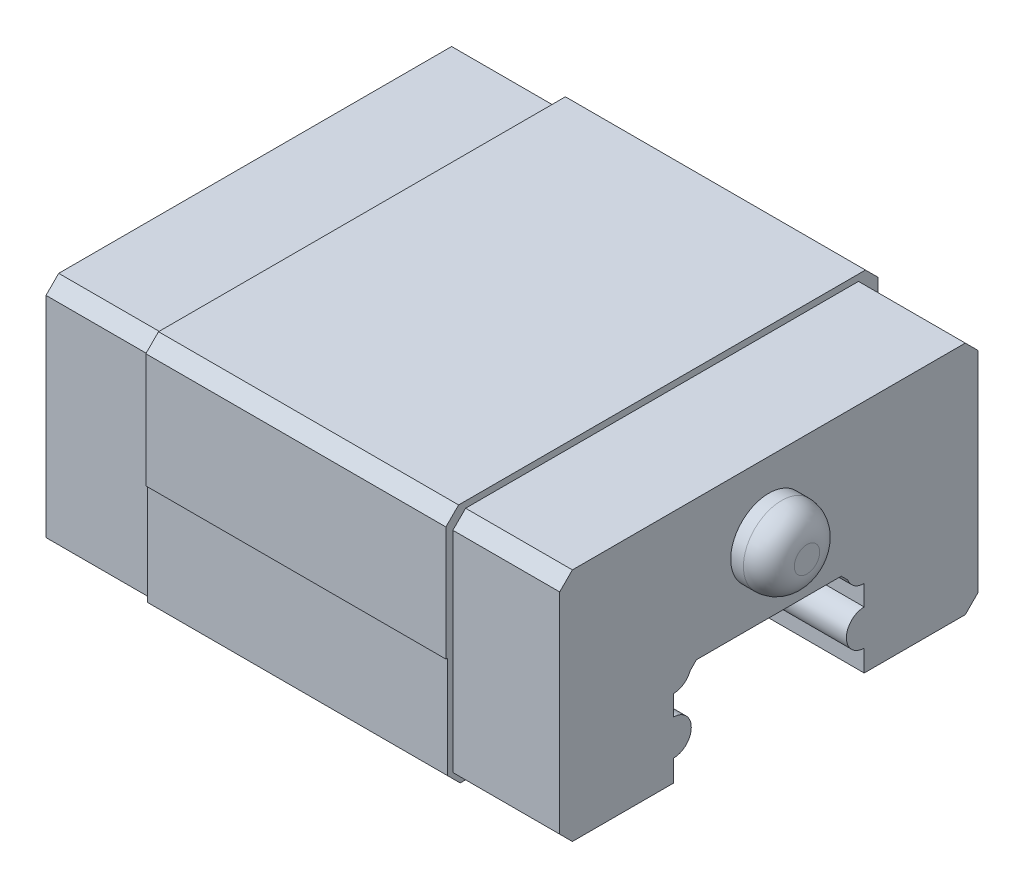
from build123d import *

# Parameters (mm, degrees)
SKETCH1_W               = 34
SKETCH1_H               = 19
BOSS_EXTRUDE1_DEPTH     = 20.2
SKETCH2_OUTSIDE_W       = 47.224
SKETCH2_OUTSIDE_H       = 32.224
SKETCH2_OUTSIDE_W_2     = 32.9
SKETCH2_OUTSIDE_H_2     = 18.5
CUT_EXTRUDE2_DEPTH      = 44.462627624
CUT_EXTRUDE8_DEPTH      = 36.679686097
CUT_EXTRUDE8_DEPTH_BACK = 36.679686097
SKETCH3_W               = 0.125
SKETCH3_H               = 9
CUT_EXTRUDE3_DEPTH      = 23.6
CHAMFER1_SIZE           = 1
CHAMFER2_SIZE           = 1
CHAMFER3_SIZE           = 1
CHAMFER4_SIZE           = 1
SKETCH10_R              = 3
BOSS_EXTRUDE3_DEPTH     = 3
FILLET1_R               = 2
SCALE_1_SCALE           = 1.7


with BuildPart() as part:
    # Sketch1 → Boss-Extrude1 (new, symmetric)
    with BuildSketch(Plane(origin=(0, 0, 0), x_dir=(0, 0, -1), z_dir=(1, 0, 0))):
        with Locations((0, 14.5)):
            Rectangle(SKETCH1_W, SKETCH1_H)
    extrude(amount=BOSS_EXTRUDE1_DEPTH, both=True)

    # Sketch2 outside → Cut-Extrude2 (cut, through all)
    with BuildSketch(Plane(origin=(11.8, 0, 0), x_dir=(0, 0, -1), z_dir=(1, 0, 0))):
        with Locations((0, 14.5)):
            Rectangle(SKETCH2_OUTSIDE_W, SKETCH2_OUTSIDE_H)
        with Locations((0, 14.25)):
            Rectangle(SKETCH2_OUTSIDE_W_2, SKETCH2_OUTSIDE_H_2, mode=Mode.SUBTRACT)
    cut_extrude2 = extrude(amount=CUT_EXTRUDE2_DEPTH, mode=Mode.SUBTRACT)

    # Mirror1: Cut-Extrude2 across plane
    add(cut_extrude2.mirror(Plane(origin=(0, 0, 0), x_dir=(0, 0, 1), z_dir=(1, 0, 0))), mode=Mode.SUBTRACT)

    # Sketch5 → Cut-Extrude8 (cut, two sides: drawn at the far end of the back side and taken through both)
    with BuildSketch(Plane(origin=(0, 0, 0), x_dir=(0, 0, -1), z_dir=(1, 0, 0)).offset(-CUT_EXTRUDE8_DEPTH_BACK)):
        with BuildLine():
            Line((-5.692330317, 12.5), (5.692330317, 12.5))
            Line((5.692330317, 12.5), (6.192330317, 12))
            ThreePointArc((6.192330317, 12), (6.706274607, 11.346743741), (7.5, 11.1))
            Line((7.5, 11.1), (7.5, 9.5))
            ThreePointArc((7.5, 9.5), (6.1, 8.1), (7.5, 6.7))
            Line((7.5, 6.7), (7.5, 1))
            Line((7.5, 1), (6.5, 0))
            Line((6.5, 0), (-6.5, 0))
            Line((-6.5, 0), (-7.5, 1))
            Line((-7.5, 1), (-7.5, 6.7))
            ThreePointArc((-7.5, 6.7), (-6.1, 8.1), (-7.5, 9.5))
            Line((-7.5, 9.5), (-7.5, 11.1))
            ThreePointArc((-7.5, 11.1), (-6.706274607, 11.346743741), (-6.192330317, 12))
            Line((-6.192330317, 12), (-5.692330317, 12.5))
        make_face()
    extrude(amount=CUT_EXTRUDE8_DEPTH + CUT_EXTRUDE8_DEPTH_BACK, mode=Mode.SUBTRACT)

    # Sketch3 → Cut-Extrude3 (cut)
    with BuildSketch(Plane(origin=(11.8, 0, 0), x_dir=(0, 0, -1), z_dir=(1, 0, 0))):
        with Locations((-16.9375, 9.5)):
            Rectangle(SKETCH3_W, SKETCH3_H)
    cut_extrude3 = extrude(amount=-CUT_EXTRUDE3_DEPTH, mode=Mode.SUBTRACT)

    # Mirror2: Cut-Extrude3 across plane
    add(cut_extrude3.mirror(Plane.XY), mode=Mode.SUBTRACT)

    # Chamfer1
    chamfer1_edges = [part.edges().sort_by_distance(p)[0] for p in [
        (-16, 23.5, 16.45),
        (-16, 23.5, -16.45),
        (16, 23.5, -16.45),
        (16, 23.5, 16.45),
    ]]
    chamfer(chamfer1_edges, length=CHAMFER1_SIZE)

    # Chamfer2
    chamfer2_edges = [part.edges().sort_by_distance(p)[0] for p in [
        (0, 24, -17),
        (0, 24, 17),
    ]]
    chamfer(chamfer2_edges, length=CHAMFER2_SIZE)

    # Chamfer3
    chamfer3_edges = [part.edges().sort_by_distance(p)[0] for p in [
        (-16, 5, -16.45),
        (16, 5, -16.45),
        (-16, 5, 16.45),
        (16, 5, 16.45),
    ]]
    chamfer(chamfer3_edges, length=CHAMFER3_SIZE)

    # Chamfer4
    chamfer4_edges = [part.edges().sort_by_distance(p)[0] for p in [
        (0, 5, -16.875),
        (0, 5, 16.875),
    ]]
    chamfer(chamfer4_edges, length=CHAMFER4_SIZE)

    # Sketch10 → Boss-Extrude3 (add)
    with BuildSketch(Plane(origin=(20.2, 0, 0), x_dir=(0, 0, -1), z_dir=(1, 0, 0))):
        with Locations((0, 18)):
            Circle(SKETCH10_R)
    extrude(amount=BOSS_EXTRUDE3_DEPTH)

    # Fillet1
    fillet1_edges = [part.edges().sort_by_distance(p)[0] for p in [
        (23.2, 18, 3),
    ]]
    fillet(fillet1_edges, radius=FILLET1_R)


with BuildPart() as part_1:
    # 缩放比例1: scaled about (0, 0, 0)
    add(part.part.scale(SCALE_1_SCALE))


solid = part_1.part
